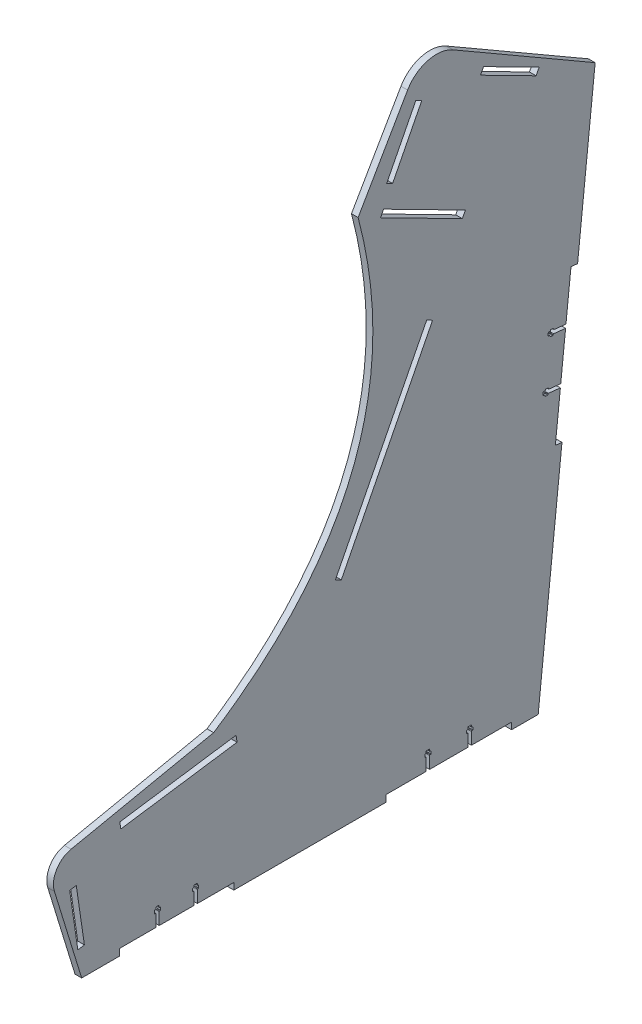
from build123d import *

# Parameters (mm, degrees)
BOSS_EXTRUDE3_DEPTH  = 6
CUT_EXTRUDE1_DEPTH   = 749.426702631
BOSS_EXTRUDE10_DEPTH = 6
BOSS_EXTRUDE11_DEPTH = 6
BOSS_EXTRUDE12_DEPTH = 6
BOSS_EXTRUDE13_DEPTH = 6
SKETCH13_W           = 113.33
SKETCH13_H           = 6
SKETCH13_W_2         = 103.33
CUT_EXTRUDE2_DEPTH   = 12
CUT_EXTRUDE4_DEPTH   = 12
SKETCH16_W           = 3.1
SKETCH16_H           = 16
CUT_EXTRUDE5_DEPTH   = 749.426702631
SKETCH17_W           = 5.5
SKETCH17_H           = 2.8
CUT_EXTRUDE6_DEPTH   = 749.426702631
FILLET1_R            = 0.4


with BuildPart() as part:
    # Sketch6 → Boss-Extrude3 (new body)
    with BuildSketch(Plane(origin=(0, 0, 0), x_dir=(0, 0, -1), z_dir=(1, 0, 0))):
        with BuildLine():
            Line((443.008381003, 0), (494.423974448, 483.65151844))
            Line((494.423974448, 483.65151844), (366.149980976, 557.801464033))
            ThreePointArc((366.149980976, 557.801464033), (343.387005566, 560.81057426), (325.163389047, 546.842482234))
            Line((325.163389047, 546.842482234), (280.507038844, 469.590255969))
            add(Edge.make_bspline(
                [(280.507038844, 469.590255969), (337.547414774, 253.666235615), (150.134747453, 132.20315818)],
                knots=[0, 0, 0, 1, 1, 1], degree=2))
            Line((150.134747453, 132.20315818), (21.492939107, 105.435528363))
            ThreePointArc((21.492939107, 105.435528363), (8.348852088, 96.029741149), (6.449920425, 79.978887114))
            Line((6.449920425, 79.978887114), (31.032803143, 0))
            Line((31.032803143, 0), (443.008381003, 0))
        make_face()
    extrude(amount=BOSS_EXTRUDE3_DEPTH)

    # Sketch7 → Cut-Extrude1 (cut, through all)
    with BuildSketch(Plane(origin=(6, 0, 0), x_dir=(0, 0, -1), z_dir=(1, 0, 0))):
        Polygon((27.561091859, 23.747572949), (16.762492935, 97.613310816), (225.041152329, 128.062038089), (374.58155558, 421.677438165), (295.408487846, 462.000842429), (343.523446296, 556.472252614), (443.849062543, 505.375705546), (441.126046449, 500.02919422), (346.146941528, 548.402725195), (303.478015265, 464.624337662), (382.651082999, 424.300933397), (228.979420855, 122.57400489), (23.567313992, 92.544345401), (33.497985095, 24.61550077), align=None)
    extrude(amount=-CUT_EXTRUDE1_DEPTH, mode=Mode.SUBTRACT)

    # Sketch9 → Boss-Extrude10 (add)
    with BuildSketch(Plane(origin=(6, 0, 0), x_dir=(0, 0, -1), z_dir=(1, 0, 0))):
        Polygon((16.762492935, 97.613310816), (20.234204219, 73.865737871), (26.171097455, 74.733665692), (22.699386171, 98.481238637), align=None)
    extrude(amount=-BOSS_EXTRUDE10_DEPTH)

    # Sketch10 → Boss-Extrude11 (add)
    with BuildSketch(Plane(origin=(6, 0, 0), x_dir=(0, 0, -1), z_dir=(1, 0, 0))):
        Polygon((22.699386171, 98.481238637), (65.494491582, 104.73755168), (66.362419403, 98.800658443), (23.567313992, 92.544345401), align=None)
        Polygon((225.041152329, 128.062038089), (170.372260446, 120.069869405), (171.240188267, 114.132976168), (228.979420855, 122.57400489), align=None)
    extrude(amount=-BOSS_EXTRUDE11_DEPTH)

    # Sketch11 → Boss-Extrude12 (add)
    with BuildSketch(Plane(origin=(6, 0, 0), x_dir=(0, 0, -1), z_dir=(1, 0, 0))):
        Polygon((382.651082999, 424.300933397), (347.705709802, 355.687371384), (342.359198476, 358.410387477), (377.304571673, 427.023949491), align=None)
        Polygon((265.334472981, 193.955403781), (228.979420855, 122.57400489), (225.041152329, 128.062038089), (259.987961656, 196.678419875), align=None)
    extrude(amount=-BOSS_EXTRUDE12_DEPTH)

    # Sketch12 → Boss-Extrude13 (add)
    with BuildSketch(Plane(origin=(6, 0, 0), x_dir=(0, 0, -1), z_dir=(1, 0, 0))):
        Polygon((295.408487846, 462.000842429), (306.300552219, 483.386887732), (311.647063545, 480.663871639), (300.754999172, 459.277826336), align=None)
        Polygon((343.523446296, 556.472252614), (332.631381923, 535.086207311), (337.977893248, 532.363191218), (346.146941528, 548.402725195), (390.968528142, 525.574773614), (393.691544235, 530.921284939), align=None)
    extrude(amount=-BOSS_EXTRUDE13_DEPTH)

    # Sketch13 → Cut-Extrude2 (cut)
    with BuildSketch(Plane(origin=(6, 0, 0), x_dir=(0, 0, -1), z_dir=(1, 0, 0))):
        with Locations((362.343381003, 3)):
            Rectangle(SKETCH13_W, SKETCH13_H)
        with Locations((116.686714336, 3)):
            Rectangle(SKETCH13_W_2, SKETCH13_H)
    extrude(amount=-CUT_EXTRUDE2_DEPTH, mode=Mode.SUBTRACT)

    # Sketch15 → Cut-Extrude4 (cut)
    with BuildSketch(Plane(origin=(6, 0, 0), x_dir=(0, 0, -1), z_dir=(1, 0, 0))):
        Polygon((464.472396543, 201.905745164), (458.506015462, 202.540013873), (472.600875653, 335.12626012), (478.567256734, 334.491991411), align=None)
    extrude(amount=-CUT_EXTRUDE4_DEPTH, mode=Mode.SUBTRACT)

    # Sketch16 → Cut-Extrude5 (cut, through all)
    with BuildSketch(Plane(origin=(6, 0, 0), x_dir=(0, 0, -1), z_dir=(1, 0, 0))):
        with Locations((99.46504767, 14)):
            Rectangle(SKETCH16_W, SKETCH16_H)
        with Locations((133.908381003, 14)):
            Rectangle(SKETCH16_W, SKETCH16_H)
        with Locations((343.45504767, 14)):
            Rectangle(SKETCH16_W, SKETCH16_H)
        with Locations((381.231714336, 14)):
            Rectangle(SKETCH16_W, SKETCH16_H)
        Polygon((463.040331985, 245.19300929), (463.368037485, 248.275639516), (447.457687935, 249.967022739), (447.129982435, 246.884392513), align=None)
        Polygon((467.73885363, 289.390634477), (468.066559129, 292.473264702), (452.156209579, 294.164647925), (451.82850408, 291.0820177), align=None)
    extrude(amount=-CUT_EXTRUDE5_DEPTH, mode=Mode.SUBTRACT)

    # Sketch17 → Cut-Extrude6 (cut, through all)
    with BuildSketch(Plane(origin=(6, 0, 0), x_dir=(0, 0, -1), z_dir=(1, 0, 0))):
        with Locations((381.231714336, 18.6)):
            Rectangle(SKETCH17_W, SKETCH17_H)
        with Locations((343.45504767, 18.6)):
            Rectangle(SKETCH17_W, SKETCH17_H)
        with Locations((133.908381003, 18.6)):
            Rectangle(SKETCH17_W, SKETCH17_H)
        with Locations((99.46504767, 18.6)):
            Rectangle(SKETCH17_W, SKETCH17_H)
        Polygon((449.57333537, 250.948876052), (452.357646541, 250.652883988), (451.776233559, 245.18370133), (448.991922387, 245.479693394), align=None)
        Polygon((454.271857015, 295.146501238), (457.056168186, 294.850509174), (456.474755203, 289.381326517), (453.690444032, 289.677318581), align=None)
    extrude(amount=-CUT_EXTRUDE6_DEPTH, mode=Mode.SUBTRACT)

    # Fillet1
    fillet1_edges = [part.edges().sort_by_distance(p)[0] for p in [
        (3, 22, -97.91504767),
        (3, 22, -101.01504767),
        (3, 291.0820177, -451.82850408),
        (3, 294.164647925, -452.156209579),
        (3, 246.884392513, -447.129982435),
        (3, 249.967022739, -447.457687935),
        (3, 22, -379.681714336),
        (3, 22, -382.781714336),
        (3, 22, -132.358381003),
        (3, 22, -135.458381003),
        (3, 22, -341.90504767),
        (3, 22, -345.00504767),
        (3, 17.2, -382.781714336),
        (3, 20, -382.781714336),
        (3, 20, -345.00504767),
        (3, 17.2, -345.00504767),
        (3, 20, -101.01504767),
        (3, 17.2, -101.01504767),
        (3, 20, -135.458381003),
        (3, 17.2, -135.458381003),
        (3, 293.657232958, -456.929314444),
        (3, 293.953225022, -454.145003273),
        (3, 249.459607772, -452.2307928),
        (3, 249.755599836, -449.446481629),
        (3, 290.870594797, -453.817297774),
        (3, 289.677318581, -453.690444032),
        (3, 290.574602733, -456.601608945),
        (3, 294.850509174, -457.056168186),
        (3, 295.146501238, -454.271857015),
        (3, 289.381326517, -456.474755203),
        (3, 17.2, -341.90504767),
        (3, 17.2, -346.20504767),
        (3, 20, -341.90504767),
        (3, 20, -340.70504767),
        (3, 20, -346.20504767),
        (3, 17.2, -340.70504767),
        (3, 17.2, -132.358381003),
        (3, 17.2, -136.658381003),
        (3, 20, -132.358381003),
        (3, 20, -131.158381003),
        (3, 20, -136.658381003),
        (3, 17.2, -131.158381003),
        (3, 17.2, -97.91504767),
        (3, 17.2, -102.21504767),
        (3, 20, -97.91504767),
        (3, 20, -96.71504767),
        (3, 20, -102.21504767),
        (3, 17.2, -96.71504767),
        (3, 246.67296961, -449.118776129),
        (3, 245.479693394, -448.991922387),
        (3, 246.376977546, -451.9030873),
        (3, 250.652883988, -452.357646541),
        (3, 250.948876052, -449.57333537),
        (3, 245.18370133, -451.776233559),
        (3, 20, -379.681714336),
        (3, 20, -378.481714336),
        (3, 17.2, -379.681714336),
        (3, 17.2, -383.981714336),
        (3, 17.2, -378.481714336),
        (3, 20, -383.981714336),
    ]]
    fillet(fillet1_edges, radius=FILLET1_R)


solid = part.part
